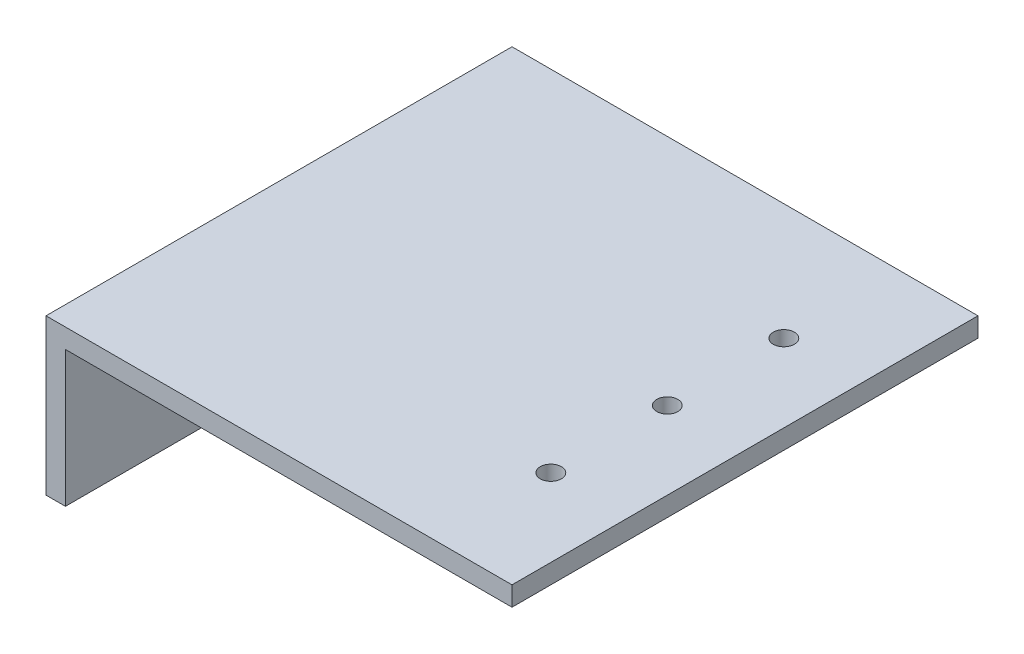
from build123d import *

# Parameters (mm, degrees)
BOSS_EXTRUDE1_DEPTH       = 76.2
CUT_EXTRUDE1_REACH        = 112.716
SKETCH7_R                 = 3.175
TAP_DRILL_FOR_8_32_TAP2_D = 3.4544
TAP_DRILL_FOR_8_32_TAP3_D = 3.4544


with BuildPart() as part:
    # Sketch2 → Boss-Extrude1 (new body)
    with BuildSketch(Plane.XY):
        Polygon((0, 0), (-76.2, 0), (-76.2, -25.4), (-73.025, -25.4), (-73.025, -3.175), (0, -3.175), align=None)
    extrude(amount=BOSS_EXTRUDE1_DEPTH)

    # Sketch7 → Cut-Extrude1 (cut, up to next)
    with BuildSketch(Plane.ZY.offset(76.2), mode=Mode.PRIVATE) as cut_extrude1_sk1:
        with Locations((38.1, -15.24)):
            Circle(SKETCH7_R)
    cut_extrude1_tool1 = extrude(cut_extrude1_sk1.sketch, amount=-CUT_EXTRUDE1_REACH, mode=Mode.PRIVATE) & part.part
    add(cut_extrude1_tool1.solids().sort_by_distance((-76.2, -15.24, 38.1))[0], mode=Mode.SUBTRACT)

    # Tap Drill for #8-32 Tap2 (through all)
    with Locations(Plane(origin=(0, 0, 0), x_dir=(1, 0, 0), z_dir=(0, 1, 0))):
        with Locations((-12.7, -19.05), (-12.7, -38.1), (-12.7, -57.15)):
            Hole(TAP_DRILL_FOR_8_32_TAP2_D / 2)

    # Tap Drill for #8-32 Tap3 (through all)
    with Locations(Plane.ZY.offset(76.2)):
        with Locations((25.4, -15.24), (50.8, -15.24)):
            Hole(TAP_DRILL_FOR_8_32_TAP3_D / 2)


solid = part.part
